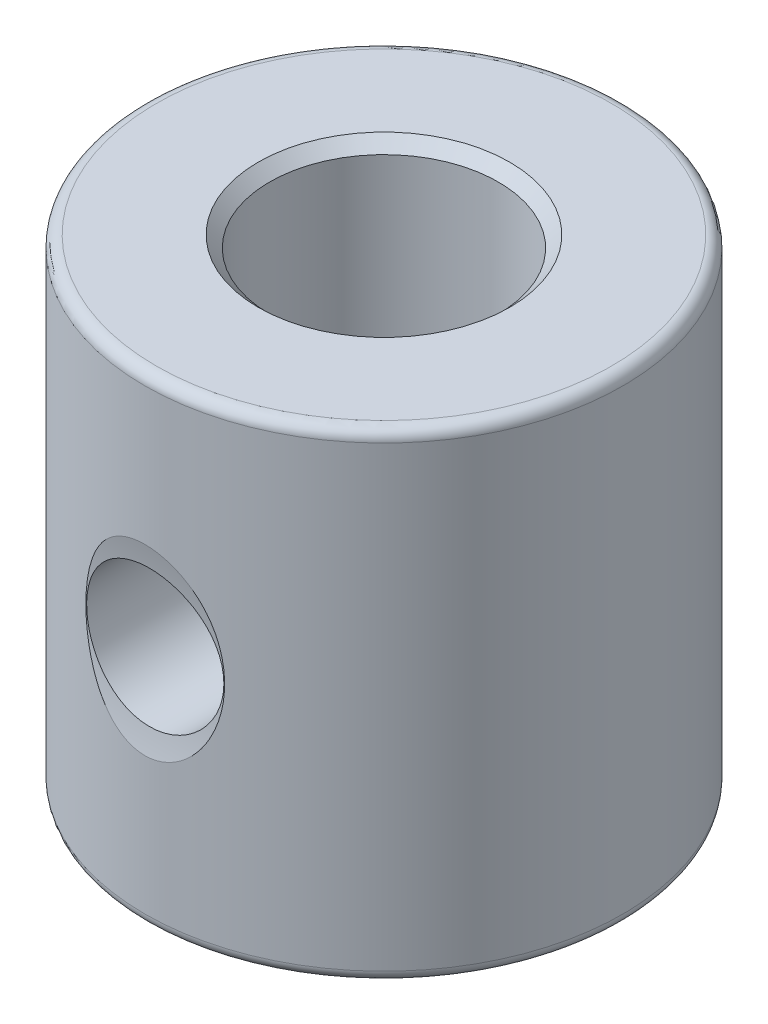
from build123d import *

# Parameters (mm, degrees)
SKETCH1_R               = 5.225
SKETCH1_R_2             = 2.5
BOSS_EXTRUDE1_DEPTH     = 5.25
SKETCH2_R               = 1.5
CUT_EXTRUDE1_DEPTH      = 5.225
CUT_EXTRUDE2_DEPTH      = 10.064422392
CUT_EXTRUDE2_DEPTH_BACK = 10.064422392
SKETCH4_R               = 9
FILLET1_R               = 0.25
CHAMFER1_SIZE           = 0.25


with BuildPart() as part:
    # Sketch1 → Boss-Extrude1 (new, symmetric)
    with BuildSketch(Plane(origin=(0, 0, 0), x_dir=(1, 0, 0), z_dir=(0, 1, 0))):
        with Locations(Location((0, 0, 0), (0, 0, 90))):
            Circle(SKETCH1_R)
        with Locations(Location((0, 0, 0), (0, 0, 90))):
            Circle(SKETCH1_R_2, mode=Mode.SUBTRACT)
    extrude(amount=BOSS_EXTRUDE1_DEPTH, both=True)

    # Sketch2 → Cut-Extrude1 (cut, symmetric)
    with BuildSketch(Plane.XY):
        Circle(SKETCH2_R)
    extrude(amount=CUT_EXTRUDE1_DEPTH, both=True, mode=Mode.SUBTRACT)

    # Sketch4 → Cut-Extrude2 (cut, two sides: drawn at the far end of the back side and taken through both)
    with BuildSketch(Plane(origin=(0, 0, 0), x_dir=(0, 0, -1), z_dir=(1, 0, 0)).offset(-CUT_EXTRUDE2_DEPTH_BACK)):
        with Locations((-14, 0)):
            Circle(SKETCH4_R)
    extrude(amount=CUT_EXTRUDE2_DEPTH + CUT_EXTRUDE2_DEPTH_BACK, mode=Mode.SUBTRACT)

    # Fillet1
    fillet1_edges = [part.edges().sort_by_distance(p)[0] for p in [
        (0, -5.25, 5.225),
        (0, 5.25, 5.225),
    ]]
    fillet(fillet1_edges, radius=FILLET1_R)

    # Chamfer1
    chamfer1_edges = [part.edges().sort_by_distance(p)[0] for p in [
        (0, 5.25, 2.5),
    ]]
    chamfer(chamfer1_edges, length=CHAMFER1_SIZE)


solid = part.part
